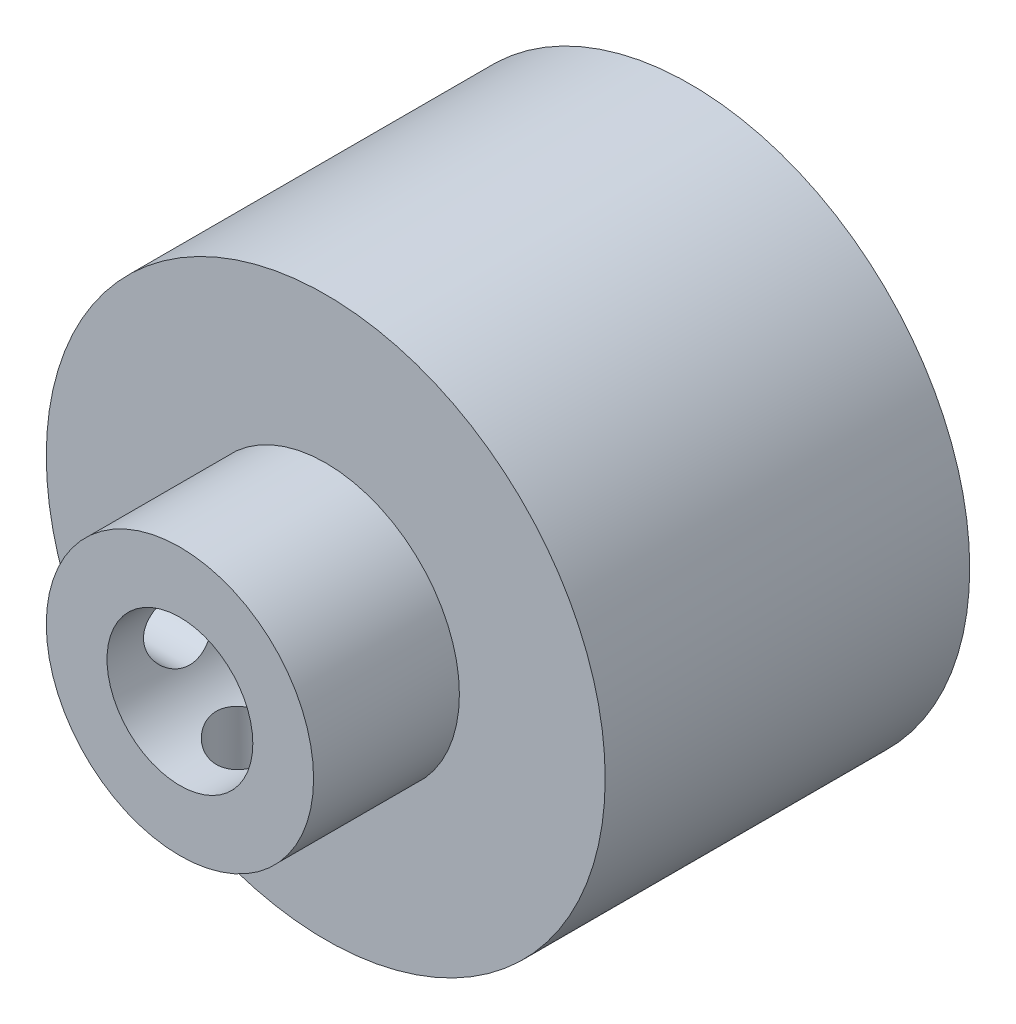
from build123d import *

# Parameters (mm, degrees)
SKETCH1_R           = 11.5
BOSS_EXTRUDE1_DEPTH = 15
SKETCH2_R           = 5.5
BOSS_EXTRUDE2_DEPTH = 6
SKETCH3_R           = 3
CUT_EXTRUDE1_DEPTH  = 27.561249971
SKETCH4_R           = 1.5
CUT_EXTRUDE2_DEPTH  = 27.561249971
SKETCH5_R           = 1.5
CUT_EXTRUDE3_DEPTH  = 27.56125005


with BuildPart() as part:
    # Sketch1 → Boss-Extrude1 (new body)
    with BuildSketch(Plane.XY):
        Circle(SKETCH1_R)
    extrude(amount=BOSS_EXTRUDE1_DEPTH)

    # Sketch2 → Boss-Extrude2 (add)
    with BuildSketch(Plane.XY.offset(15)):
        Circle(SKETCH2_R)
    extrude(amount=BOSS_EXTRUDE2_DEPTH)

    # Sketch3 → Cut-Extrude1 (cut, through all)
    with BuildSketch(Plane.XY.offset(21)):
        Circle(SKETCH3_R)
    extrude(amount=-CUT_EXTRUDE1_DEPTH, mode=Mode.SUBTRACT)

    # Sketch4 → Cut-Extrude2 (cut, through all)
    with BuildSketch(Plane(origin=(0, 0, 0), x_dir=(1, 0, 0), z_dir=(0, 1, 0))):
        with Locations(Location((0, -18, 0), (0, 0, 270))):
            Circle(SKETCH4_R)
    extrude(amount=-CUT_EXTRUDE2_DEPTH, mode=Mode.SUBTRACT)

    # Sketch5 → Cut-Extrude3 (cut, through all)
    with BuildSketch(Plane(origin=(0, 0, 0), x_dir=(0, 0, -1), z_dir=(1, 0, 0))):
        with Locations((-18, 0)):
            Circle(SKETCH5_R)
    extrude(amount=-CUT_EXTRUDE3_DEPTH, mode=Mode.SUBTRACT)


solid = part.part
